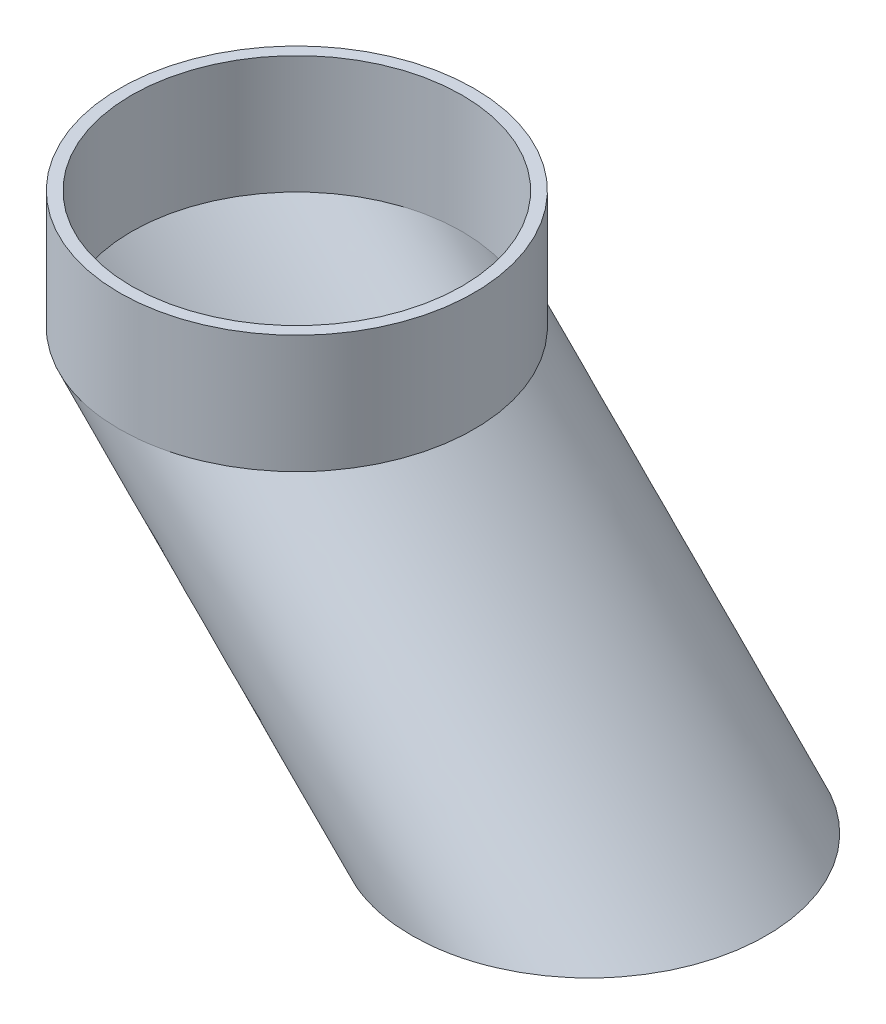
from build123d import *

# Parameters (mm, degrees)
SKETCH1_R           = 15
SKETCH1_R_2         = 14
EXTRUDE_THIN1_DEPTH = 10
SKETCH2_R           = 15
SKETCH2_R_2         = 14


with BuildPart() as part:
    # Sketch1 → Extrude-Thin1 (new body)
    with BuildSketch(Plane(origin=(0, 0, 0), x_dir=(1, 0, 0), z_dir=(0, 1, 0))):
        Circle(SKETCH1_R)
        Circle(SKETCH1_R_2, mode=Mode.SUBTRACT)
    extrude(amount=EXTRUDE_THIN1_DEPTH)

    # Sweep1: sweep along a path in Sketch4
    with BuildLine(Plane.XY) as sweep1_path:
        Line((0, 0), (24.748737342, -24.748737342))
    # Sketch2 → Sweep1 (sweep)
    with BuildSketch(Plane.XZ):
        Circle(SKETCH2_R)
        Circle(SKETCH2_R_2, mode=Mode.SUBTRACT)
    sweep(path=sweep1_path.line)


solid = part.part
